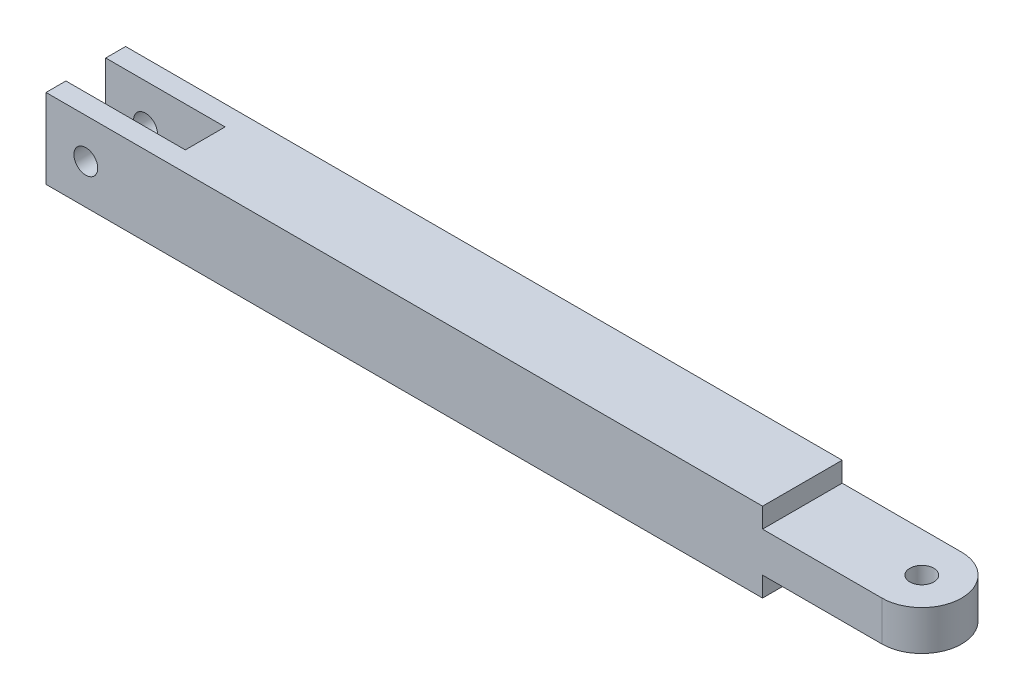
from build123d import *

# Parameters (mm, degrees)
SALIENTE_EXTRUIR1_DEPTH = 10
CROQUIS2_W              = 10
CROQUIS2_H              = 5
SALIENTE_EXTRUIR2_DEPTH = 10
CROQUIS4_R              = 1.5
CORTAR_EXTRUIR1_DEPTH   = 10
CROQUIS5_R              = 1.5
CORTAR_EXTRUIR2_DEPTH   = 9.5
SKETCH1_W               = 10
SKETCH1_H               = 2.5
CUT_EXTRUDE1_DEPTH      = 10


with BuildPart() as part:
    # Croquis1 → Saliente-Extruir1 (new body)
    with BuildSketch(Plane(origin=(0, 0, 0), x_dir=(1, 0, 0), z_dir=(0, 1, 0))):
        Polygon((-50, 2.5), (-50, 5), (50, 5), (50, -5), (-50, -5), (-50, -2.5), (-35, -2.5), (-35, 2.5), align=None)
    extrude(amount=SALIENTE_EXTRUIR1_DEPTH)

    # Croquis2 → Saliente-Extruir2 (add)
    with BuildSketch(Plane(origin=(50, 0, 0), x_dir=(0, 0, -1), z_dir=(1, 0, 0))):
        with Locations((0, 5)):
            Rectangle(CROQUIS2_W, CROQUIS2_H)
    extrude(amount=SALIENTE_EXTRUIR2_DEPTH)

    # Croquis4 → Cortar-Extruir1 (cut)
    with BuildSketch(Plane(origin=(0, 7.5, 0), x_dir=(1, 0, 0), z_dir=(0, 1, 0))):
        with Locations(Location((55, 0, 0), (0, 0, 270))):
            Circle(CROQUIS4_R)
        with BuildLine():
            Line((55, 5), (55, 11.029230351))
            Line((55, 11.029230351), (66.142651686, 11.029230351))
            Line((66.142651686, 11.029230351), (66.142651686, -12.901676623))
            Line((66.142651686, -12.901676623), (58.757445268, -12.901676623))
            Line((58.757445268, -12.901676623), (55, -5))
            ThreePointArc((55, -5), (60, 0), (55, 5))
        make_face()
    extrude(amount=-CORTAR_EXTRUIR1_DEPTH, mode=Mode.SUBTRACT)

    # Croquis5 → Cortar-Extruir2 (cut, symmetric)
    with BuildSketch(Plane(origin=(0, 0, 2.5), x_dir=(-1, 0, 0), z_dir=(0, 0, -1))):
        with Locations((45, 5)):
            Circle(CROQUIS5_R)
    extrude(amount=CORTAR_EXTRUIR2_DEPTH, both=True, mode=Mode.SUBTRACT)

    # Sketch1 → Cut-Extrude1 (cut)
    with BuildSketch(Plane(origin=(50, 0, 0), x_dir=(0, 0, -1), z_dir=(1, 0, 0))):
        with Locations((0, 8.75)):
            Rectangle(SKETCH1_W, SKETCH1_H)
        with Locations((0, 1.25)):
            Rectangle(SKETCH1_W, SKETCH1_H)
    extrude(amount=-CUT_EXTRUDE1_DEPTH, mode=Mode.SUBTRACT)


solid = part.part
